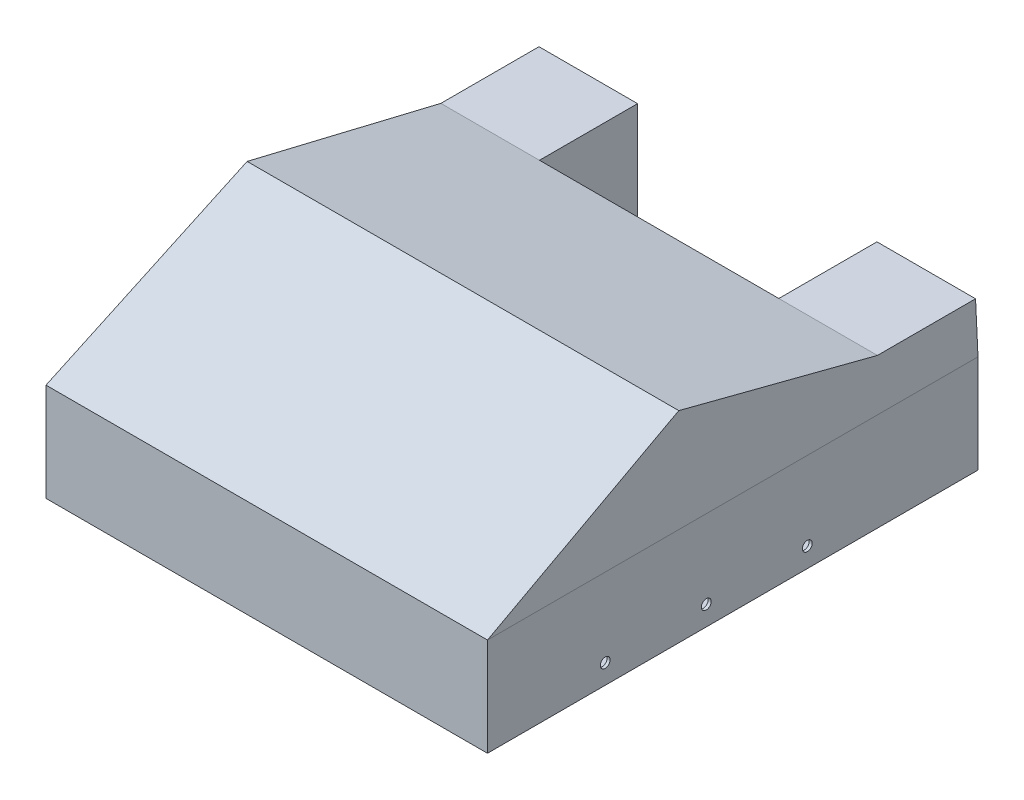
from build123d import *

# Parameters (mm, degrees)
BOSS_EXTRUDE1_DEPTH     = 450
CUT_EXTRUDE1_START      = -3
CUT_EXTRUDE1_DEPTH      = 444
SKETCH4_W               = 250
SKETCH4_H               = 144
CUT_EXTRUDE2_DEPTH      = 100
SKETCH5_R               = 112.5
CUT_EXTRUDE3_DEPTH      = 3
CUT_EXTRUDE5_DEPTH      = 553.268050859
CUT_EXTRUDE5_DEPTH_BACK = 553.268050859
SKETCH7_R               = 5
BOSS_EXTRUDE2_DEPTH     = 7
BOSS_EXTRUDE3_DEPTH     = 7
CUT_EXTRUDE7_DEPTH      = 702.783442381
CUT_EXTRUDE7_DEPTH_BACK = 702.783442381
SKETCH12_W              = 100
SKETCH12_H              = 147.055014966
BOSS_EXTRUDE4_DEPTH     = 3
SKETCH14_W              = 100
SKETCH14_H              = 147
BOSS_EXTRUDE5_DEPTH     = 3
SKETCH15_R              = 2
CUT_EXTRUDE8_DEPTH      = 3


with BuildPart() as part:
    # Sketch2 → Boss-Extrude1 (new body)
    with BuildSketch(Plane(origin=(0, 0, 0), x_dir=(0, 0, -1), z_dir=(1, 0, 0))):
        Polygon((-250, 0), (250, 0), (250, 150), (150, 150), (-50, 200), (-250, 100), align=None)
    extrude(amount=-BOSS_EXTRUDE1_DEPTH)

    # Sketch3 → Cut-Extrude1 (cut)
    with BuildSketch(Plane(origin=(0, 0, 0), x_dir=(0, 0, -1), z_dir=(1, 0, 0)).offset(CUT_EXTRUDE1_START)):
        Polygon((-247, 98.145898034), (-247, 3), (247, 3), (247, 147), (149.630683123, 147), (-49.650969671, 196.820413198), align=None)
    extrude(amount=-CUT_EXTRUDE1_DEPTH, mode=Mode.SUBTRACT)

    # Sketch4 → Cut-Extrude2 (cut)
    with BuildSketch(Plane(origin=(0, 0, -250), x_dir=(-1, 0, 0), z_dir=(0, 0, -1))):
        with Locations((225, 78)):
            Rectangle(SKETCH4_W, SKETCH4_H)
    extrude(amount=-CUT_EXTRUDE2_DEPTH, mode=Mode.SUBTRACT)

    # Sketch5 → Cut-Extrude3 (cut)
    with BuildSketch(Plane.XZ):
        with Locations(Location((-225, 0, 0), (0, 0, 270))):
            Circle(SKETCH5_R)
    extrude(amount=-CUT_EXTRUDE3_DEPTH, mode=Mode.SUBTRACT)

    # Sketch7 → Cut-Extrude5 (cut, two sides: drawn at the far end of the back side and taken through both)
    with BuildSketch(Plane(origin=(0, 0, 0), x_dir=(0, 0, -1), z_dir=(1, 0, 0)).offset(-CUT_EXTRUDE5_DEPTH_BACK)):
        with Locations((-130, 20)):
            Circle(SKETCH7_R)
        with Locations((-27, 20)):
            Circle(SKETCH7_R)
        with Locations((76, 20)):
            Circle(SKETCH7_R)
    extrude(amount=CUT_EXTRUDE5_DEPTH + CUT_EXTRUDE5_DEPTH_BACK, mode=Mode.SUBTRACT)

    # Sketch9 → Boss-Extrude2 (add)
    with BuildSketch(Plane(origin=(0, 0, 0), x_dir=(0, 0, -1), z_dir=(1, 0, 0))):
        Polygon((-250, 100), (250, 100), (250, 150), (150, 150), (-50, 200), align=None)
    extrude(amount=-BOSS_EXTRUDE2_DEPTH)

    # Sketch10 → Boss-Extrude3 (add)
    with BuildSketch(Plane.ZY.offset(450)):
        Polygon((250, 100), (50, 200), (-150, 150), (-250, 150), (-250, 100), align=None)
    extrude(amount=-BOSS_EXTRUDE3_DEPTH)

    # Sketch11 → Cut-Extrude7 (cut, two sides: drawn at the far end of the back side and taken through both)
    with BuildSketch(Plane.XY.offset(250).offset(-CUT_EXTRUDE7_DEPTH_BACK)):
        Polygon((0, 100), (0, 200), (-5, 200), align=None)
        Polygon((-450, 200), (-450, 100), (-445, 200), align=None)
    extrude(amount=CUT_EXTRUDE7_DEPTH + CUT_EXTRUDE7_DEPTH_BACK, mode=Mode.SUBTRACT)

    # Sketch12 → Boss-Extrude4 (add)
    with BuildSketch(Plane.ZY.offset(100)):
        with Locations((-200, 76.472492517)):
            Rectangle(SKETCH12_W, SKETCH12_H)
    extrude(amount=BOSS_EXTRUDE4_DEPTH)

    # Sketch14 → Boss-Extrude5 (add)
    with BuildSketch(Plane(origin=(-350, 0, 0), x_dir=(0, 0, -1), z_dir=(1, 0, 0))):
        with Locations((200, 76.5)):
            Rectangle(SKETCH14_W, SKETCH14_H)
    extrude(amount=BOSS_EXTRUDE5_DEPTH)

    # Sketch15 → Cut-Extrude8 (cut)
    with BuildSketch(Plane(origin=(0, 3, 0), x_dir=(1, 0, 0), z_dir=(0, 1, 0))):
        with Locations(Location((-400, 96, 0), (0, 0, 270))):
            Circle(SKETCH15_R)
        with Locations(Location((-400, 56, 0), (0, 0, 270))):
            Circle(SKETCH15_R)
        with Locations(Location((-400, -7, 0), (0, 0, 270))):
            Circle(SKETCH15_R)
        with Locations(Location((-400, -47, 0), (0, 0, 270))):
            Circle(SKETCH15_R)
        with Locations(Location((-400, -110, 0), (0, 0, 270))):
            Circle(SKETCH15_R)
        with Locations(Location((-400, -150, 0), (0, 0, 270))):
            Circle(SKETCH15_R)
        with Locations(Location((-50, -150, 0), (0, 0, 90))):
            Circle(SKETCH15_R)
        with Locations(Location((-50, -110, 0), (0, 0, 90))):
            Circle(SKETCH15_R)
        with Locations(Location((-50, -47, 0), (0, 0, 90))):
            Circle(SKETCH15_R)
        with Locations(Location((-50, -7, 0), (0, 0, 90))):
            Circle(SKETCH15_R)
        with Locations(Location((-50, 56, 0), (0, 0, 90))):
            Circle(SKETCH15_R)
        with Locations(Location((-50, 96, 0), (0, 0, 90))):
            Circle(SKETCH15_R)
    extrude(amount=-CUT_EXTRUDE8_DEPTH, mode=Mode.SUBTRACT)


solid = part.part
